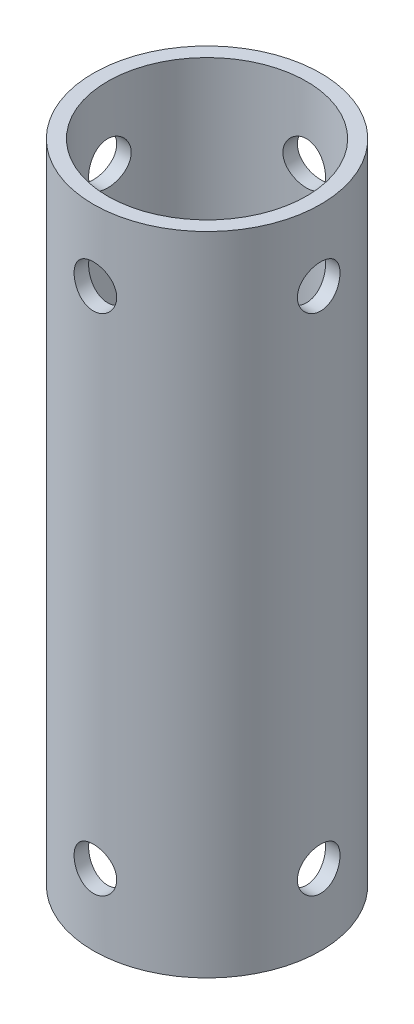
from build123d import *

# Parameters (mm, degrees)
SKETCH1_R           = 16
SKETCH1_R_2         = 14
BOSS_EXTRUDE1_DEPTH = 91
SKETCH2_R           = 3
CUT_EXTRUDE1_DEPTH  = 10
CIRPATTERN1_COUNT   = 4


with BuildPart() as part:
    # Sketch1 → Boss-Extrude1 (new body)
    with BuildSketch(Plane(origin=(0, 0, 0), x_dir=(1, 0, 0), z_dir=(0, 1, 0))):
        with Locations(Location((0, 0, 0), (0, 0, 270))):
            Circle(SKETCH1_R)
        with Locations(Location((0, 0, 0), (0, 0, 270))):
            Circle(SKETCH1_R_2, mode=Mode.SUBTRACT)
    extrude(amount=BOSS_EXTRUDE1_DEPTH)

    # Sketch2 → Cut-Extrude1 (cut)
    with BuildSketch(Plane(origin=(0, 0, -16), x_dir=(-1, 0, 0), z_dir=(0, 0, -1))):
        with Locations(Location((0, 10, 0), (0, 0, 90))):
            Circle(SKETCH2_R)
        with Locations(Location((0, 81, 0), (0, 0, 90))):
            Circle(SKETCH2_R)
    cut_extrude1 = extrude(amount=-CUT_EXTRUDE1_DEPTH, mode=Mode.SUBTRACT)

    # CirPattern1: Cut-Extrude1 ×4 about axis
    cirpattern1_axis = Axis((0, 91, 0), (0, -1, 0))
    for i in range(1, CIRPATTERN1_COUNT):
        add(cut_extrude1.rotate(cirpattern1_axis, i * 360 / CIRPATTERN1_COUNT), mode=Mode.SUBTRACT)


solid = part.part
